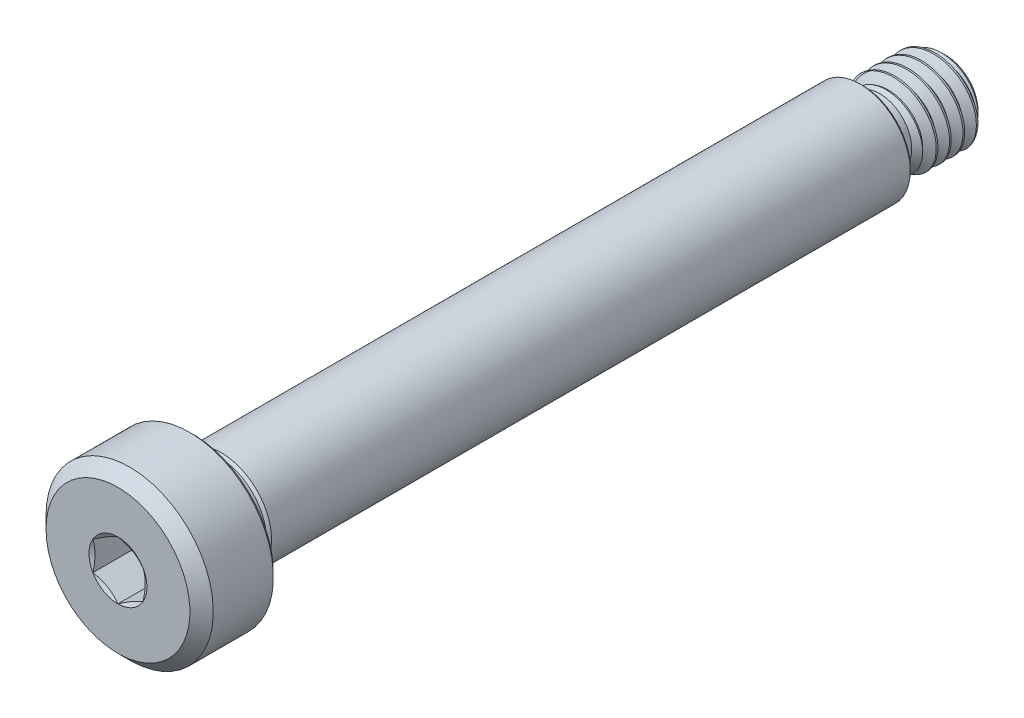
from build123d import *

# Parameters (mm, degrees)
CUT_EXTRUDE1_DEPTH     = 2.475
CUT_SWEEP1_PITCH       = 0.8
CUT_SWEEP1_HEIGHT      = 5.8
CUT_SWEEP1_RADIUS      = 2.5
CUT_SWEEP1_START_ANGLE = 90


with BuildPart() as part:
    # Sketch6 → Revolve1 (revolve)
    with BuildSketch(Plane(origin=(0, 0, 0), x_dir=(0, 0, -1), z_dir=(1, 0, 0)), mode=Mode.PRIVATE) as revolve1_sk:
        with BuildLine():
            Line((-24.75, 0), (-24.75, 4.3))
            Line((-24.75, 4.3), (-24.05, 5))
            Line((-24.05, 5), (-20.46, 5))
            Line((-20.46, 5), (-20.25, 4.79))
            Line((-20.25, 4.79), (-20.25, 3.15))
            ThreePointArc((-20.25, 3.15), (-20.162132034, 2.937867966), (-19.95, 2.85))
            Line((-19.95, 2.85), (-18.72, 2.85))
            Line((-18.72, 2.85), (-18.57, 3))
            Line((-18.57, 3), (19.6, 3))
            Line((19.6, 3), (19.75, 2.85))
            Line((19.75, 2.85), (19.75, 2.2))
            ThreePointArc((19.75, 2.2), (19.837867966, 1.987867966), (20.05, 1.9))
            Line((20.05, 1.9), (20.79, 1.9))
            Line((20.79, 1.9), (21.39, 2.5))
            Line((21.39, 2.5), (24.15, 2.5))
            Line((24.15, 2.5), (24.75, 1.9))
            Line((24.75, 1.9), (24.75, 0))
            Line((24.75, 0), (-24.75, 0))
        make_face()
    revolve(revolve1_sk.sketch.rotate(Axis((0, 0, -24.75), (0, 0, 1)), 90), axis=Axis((0, 0, -24.75), (0, 0, 1)))

    # Sketch7 → Cut-Extrude1 (cut)
    with BuildSketch(Plane.XY.offset(24.75)):
        Polygon((0, -1.732050808), (1.5, -0.866025404), (1.5, 0.866025404), (0, 1.732050808), (-1.5, 0.866025404), (-1.5, -0.866025404), align=None)
    extrude(amount=-CUT_EXTRUDE1_DEPTH, mode=Mode.SUBTRACT)

    # Cut-Extrude2 cone 1 section (through the dimple's axis) → Cut-Extrude2 (revolve, cut)
    with BuildSketch(Plane(origin=(0, 0, 24.75), x_dir=(0, -1, 0), z_dir=(1, 0, 0))):
        Polygon((0, 0), (1.732050808, 0), (0, 1), align=None)
    revolve(axis=Axis((0, 0, 24.75), (0, 0, -1)), mode=Mode.SUBTRACT)


with BuildPart() as body_2:
    # Split1: the piece on the far side of the plane
    add(part.part)
    split(bisect_by=Plane.XY.offset(-20.79), keep=Keep.BOTTOM)

    # Cut-Sweep1: sweep along a helix
    with BuildLine() as cut_sweep1_path:
        add(Helix(CUT_SWEEP1_PITCH, CUT_SWEEP1_HEIGHT, CUT_SWEEP1_RADIUS, center=(0, 0, -24.75), direction=(0, 0, 1), mode=Mode.PRIVATE).rotate(Axis((0, 0, -24.75), (0, 0, 1)), CUT_SWEEP1_START_ANGLE))
    # Sketch11 → Cut-Sweep1 (sweep, cut)
    with BuildSketch(Plane(origin=(0, 0, 0), x_dir=(0, 0, -1), z_dir=(1, 0, 0))):
        Polygon((24.725, 2.54330127), (25.475, 2.54330127), (25.15, 1.980384758), (25.05, 1.980384758), align=None)
    sweep(path=cut_sweep1_path.line, is_frenet=True, mode=Mode.SUBTRACT)


with BuildPart() as part_1:
    add(part.part)

    # Split1
    split(bisect_by=Plane.XY.offset(-20.79), keep=Keep.TOP)


with BuildPart() as body_2_1:
    add(body_2.part)

    # Combine1: union part
    add(part_1.part)


solid = body_2_1.part
